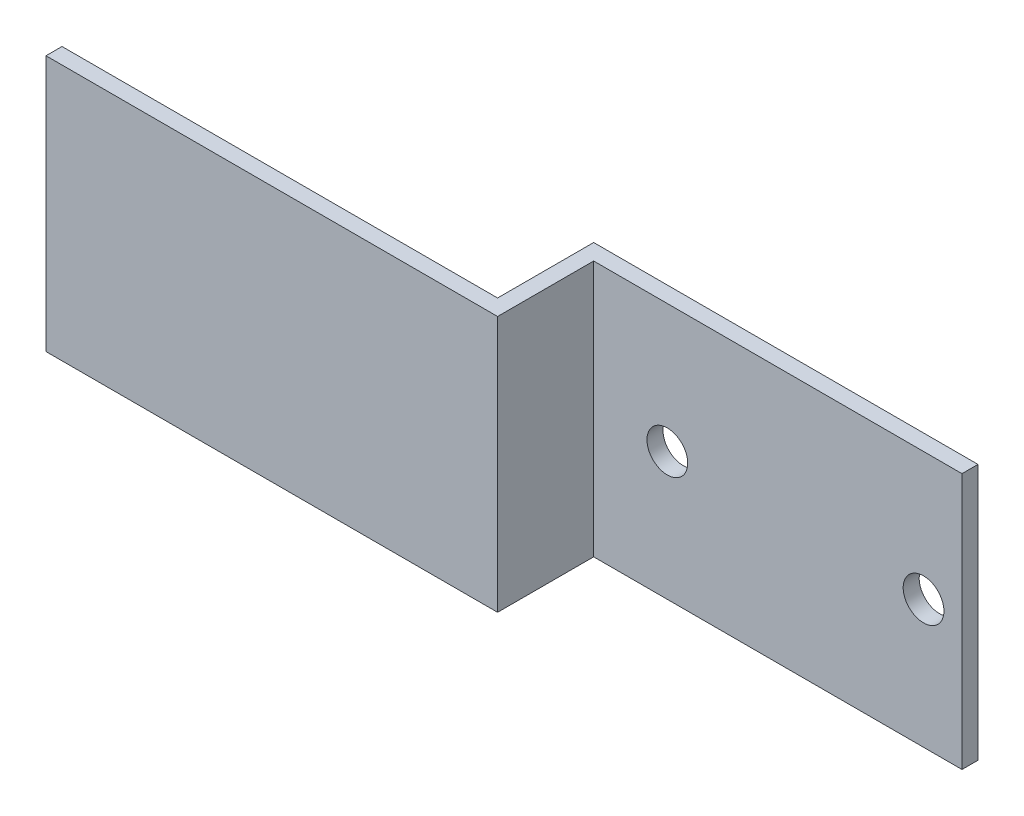
from build123d import *

# Parameters (mm, degrees)
SKETCH1_W           = 38.1
SKETCH1_H           = 25.4
BOSS_EXTRUDE1_DEPTH = 1.5875
SKETCH3_W           = 9.525
SKETCH3_H           = 25.4
BOSS_EXTRUDE2_DEPTH = 1.5875
SKETCH4_W           = 43.18
SKETCH4_H           = 25.4
BOSS_EXTRUDE3_DEPTH = 1.5875
SKETCH2_R           = 2.0193
CUT_EXTRUDE1_DEPTH  = 2.54
LPATTERN1_COUNT     = 2
LPATTERN1_PITCH     = 25.4


with BuildPart() as part:
    # Sketch1 → Boss-Extrude1 (new body)
    with BuildSketch(Plane.XY):
        with Locations((19.05, 12.7)):
            Rectangle(SKETCH1_W, SKETCH1_H)
    extrude(amount=BOSS_EXTRUDE1_DEPTH)

    # Sketch3 → Boss-Extrude2 (add)
    with BuildSketch(Plane.ZY):
        with Locations((6.35, 12.7)):
            Rectangle(SKETCH3_W, SKETCH3_H)
    extrude(amount=-BOSS_EXTRUDE2_DEPTH)

    # Sketch4 → Boss-Extrude3 (add)
    with BuildSketch(Plane.XY.offset(11.1125)):
        with Locations((-21.59, 12.7)):
            Rectangle(SKETCH4_W, SKETCH4_H)
    extrude(amount=-BOSS_EXTRUDE3_DEPTH)

    # Sketch2 → Cut-Extrude1 (cut)
    with BuildSketch(Plane.XY.offset(1.5875)):
        with Locations((34.29, 12.7)):
            Circle(SKETCH2_R)
    cut_extrude1 = extrude(amount=-CUT_EXTRUDE1_DEPTH, mode=Mode.SUBTRACT)

    # LPattern1: Cut-Extrude1 ×2
    with Locations(*[(-i * LPATTERN1_PITCH, 0, 0) for i in range(1, LPATTERN1_COUNT)]):
        add(cut_extrude1, mode=Mode.SUBTRACT)


solid = part.part
